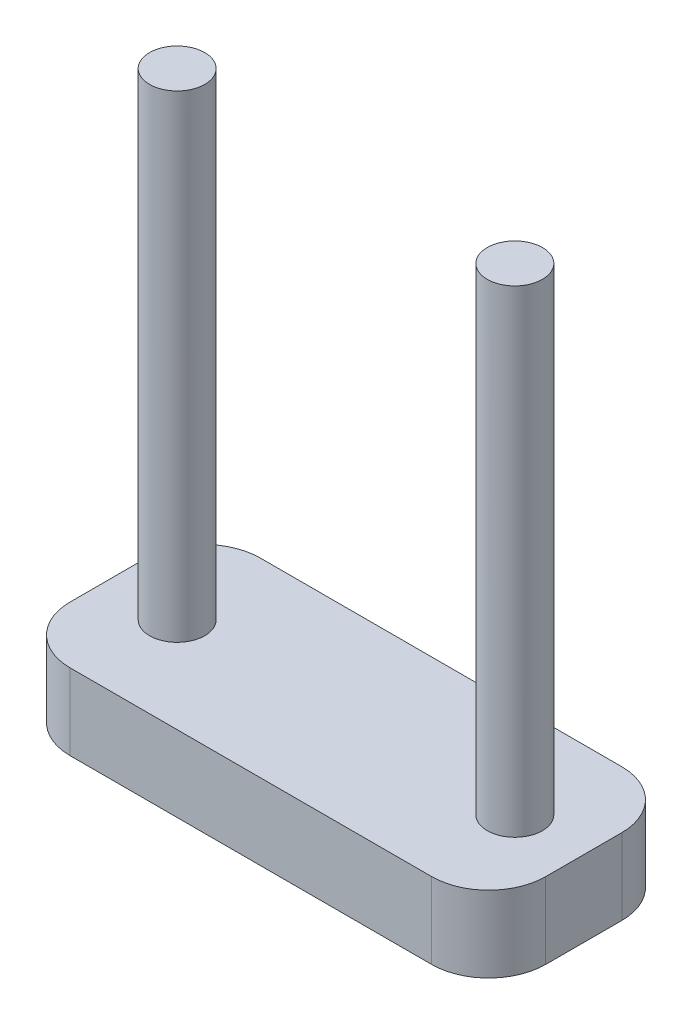
from build123d import *

# Parameters (mm, degrees)
SKETCH1_W           = 25
SKETCH1_H           = 10
BOSS_EXTRUDE1_DEPTH = 4
SKETCH2_R           = 1.45
BOSS_EXTRUDE2_DEPTH = 25.1
FILLET1_R           = 3


with BuildPart() as part:
    # Sketch1 → Boss-Extrude1 (new body)
    with BuildSketch(Plane(origin=(0, 0, 0), x_dir=(1, 0, 0), z_dir=(0, 1, 0))):
        Rectangle(SKETCH1_W, SKETCH1_H)
    extrude(amount=BOSS_EXTRUDE1_DEPTH)

    # Sketch2 → Boss-Extrude2 (add)
    with BuildSketch(Plane(origin=(0, 4, 0), x_dir=(1, 0, 0), z_dir=(0, 1, 0))):
        with Locations(Location((8.875, 0, 0), (0, 0, 90))):
            Circle(SKETCH2_R)
        with Locations(Location((-8.875, 0, 0), (0, 0, 90))):
            Circle(SKETCH2_R)
    extrude(amount=BOSS_EXTRUDE2_DEPTH)

    # Fillet1
    fillet1_edges = [part.edges().sort_by_distance(p)[0] for p in [
        (12.5, 2, 5),
        (-12.5, 2, 5),
        (-12.5, 2, -5),
        (12.5, 2, -5),
    ]]
    fillet(fillet1_edges, radius=FILLET1_R)


solid = part.part
